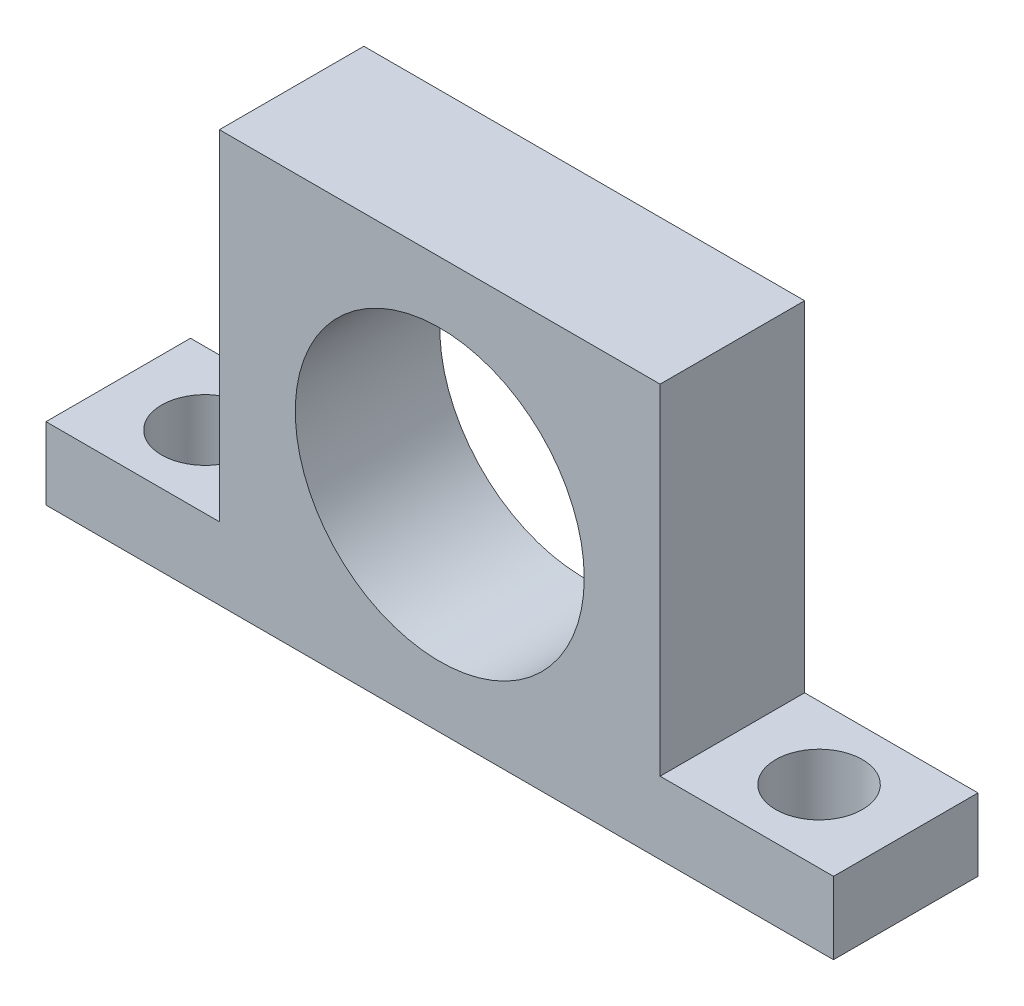
from build123d import *

# Parameters (mm, degrees)
SKETCH_1_R          = 10
EXTRUDE_1_DEPTH     = 10
SKETCH_2_R          = 3
CUT_EXTRUDE_1_DEPTH = 43.114991393


with BuildPart() as part:
    # 草图1 → 凸台-拉伸1 (new body)
    with BuildSketch(Plane.XY):
        Polygon((17.35, 7.3), (-13.15, 7.3), (-13.15, -16.2), (-25.15, -16.2), (-25.15, -21.2), (29.35, -21.2), (29.35, -16.2), (17.35, -16.2), align=None)
        with Locations((2.1, -6.95)):
            Circle(SKETCH_1_R, mode=Mode.SUBTRACT)
    extrude(amount=EXTRUDE_1_DEPTH)

    # 草图2 → 切除-拉伸1 (cut, through all)
    with BuildSketch(Plane(origin=(0, 7.3, 0), x_dir=(1, 0, 0), z_dir=(0, 1, 0))):
        with Locations(Location((-19.15, -5, 0), (0, 0, 180))):
            Circle(SKETCH_2_R)
        with Locations((23.35, -5)):
            Circle(SKETCH_2_R)
    extrude(amount=-CUT_EXTRUDE_1_DEPTH, mode=Mode.SUBTRACT)


solid = part.part
